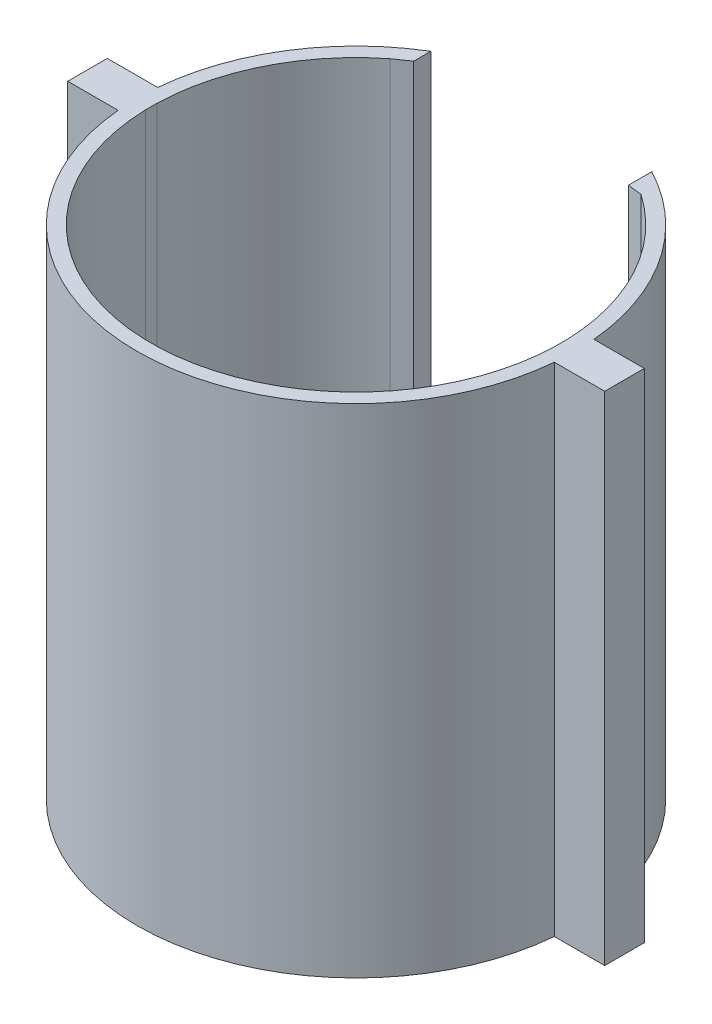
from build123d import *

# Parameters (mm, degrees)
BOSS_EXTRUDE1_DEPTH = 44.704
CUT_EXTRUDE1_DEPTH  = 55.481223747
CUT_EXTRUDE2_DEPTH  = 55.481223747


with BuildPart() as part:
    # Sketch1 → Boss-Extrude1 (new body)
    with BuildSketch(Plane(origin=(0, 0, 0), x_dir=(1, 0, 0), z_dir=(0, 1, 0))):
        with BuildLine():
            Line((19.604538786, -1.778), (-19.604538786, -1.778))
            ThreePointArc((-19.604538786, -1.778), (0, -19.685), (19.604538786, -1.778))
        make_face()
        with BuildLine():
            Line((-24.13, 1.778), (-24.13, -1.778))
            Line((-24.13, -1.778), (-19.604538786, -1.778))
            ThreePointArc((-19.604538786, -1.778), (-19.685, 0), (-19.604538786, 1.778))
            Line((-19.604538786, 1.778), (-24.13, 1.778))
        make_face()
        with BuildLine():
            ThreePointArc((19.685, 0), (19.664874408, -0.889909828), (19.604538786, -1.778))
            Line((19.604538786, -1.778), (24.13, -1.778))
            Line((24.13, -1.778), (24.13, 1.778))
            Line((24.13, 1.778), (19.604538786, 1.778))
            ThreePointArc((19.604538786, 1.778), (19.664874408, 0.889909828), (19.685, 0))
        make_face()
        with BuildLine():
            ThreePointArc((-19.604538786, 1.778), (-19.685, 0), (-19.604538786, -1.778))
            Line((-19.604538786, -1.778), (19.604538786, -1.778))
            ThreePointArc((19.604538786, -1.778), (19.664874408, -0.889909828), (19.685, 0))
            ThreePointArc((19.685, 0), (19.664874408, 0.889909828), (19.604538786, 1.778))
            Line((19.604538786, 1.778), (-19.604538786, 1.778))
        make_face()
        with BuildLine():
            ThreePointArc((-10.145068686, 16.869404446), (-16.679250829, 10.454750919), (-19.604538786, 1.778))
            Line((-19.604538786, 1.778), (19.604538786, 1.778))
            ThreePointArc((19.604538786, 1.778), (16.371852187, 10.929852742), (9.158931314, 17.424500056))
            Line((9.158931314, 17.424500056), (9.158931314, 11.559229776))
            Line((9.158931314, 11.559229776), (-10.145068686, 11.559229776))
            Line((-10.145068686, 11.559229776), (-10.145068686, 16.869404446))
        make_face()
    extrude(amount=BOSS_EXTRUDE1_DEPTH)

    # Sketch3 → Cut-Extrude1 (cut, through all)
    with BuildSketch(Plane(origin=(0, 44.704, 0), x_dir=(1, 0, 0), z_dir=(0, 1, 0))):
        with BuildLine():
            Line((-18.40799177, 0.508), (-18.40799177, -0.508))
            ThreePointArc((-18.40799177, -0.508), (0, -18.415), (18.40799177, -0.508))
            Line((18.40799177, -0.508), (18.40799177, 0.508))
            ThreePointArc((18.40799177, 0.508), (16.176802096, 8.799051026), (10.428931314, 15.177273031))
            Line((10.428931314, 15.177273031), (10.428931314, 10.289229776))
            Line((10.428931314, 10.289229776), (-11.415068686, 10.289229776))
            Line((-11.415068686, 10.289229776), (-11.415068686, 14.450205254))
            ThreePointArc((-11.415068686, 14.450205254), (-16.460559091, 8.256041389), (-18.40799177, 0.508))
        make_face()
    extrude(amount=-CUT_EXTRUDE1_DEPTH, mode=Mode.SUBTRACT)

    # Sketch4 → Cut-Extrude2 (cut, through all)
    with BuildSketch(Plane(origin=(0, 44.704, 0), x_dir=(1, 0, 0), z_dir=(0, 1, 0))):
        Polygon((-11.415068686, 14.450205254), (-10.145068686, 15.334289128), (9.158931314, 15.334289128), (10.428931314, 15.177273031), (10.428931314, 10.289229776), (-11.415068686, 10.289229776), align=None)
    extrude(amount=-CUT_EXTRUDE2_DEPTH, mode=Mode.SUBTRACT)


solid = part.part
